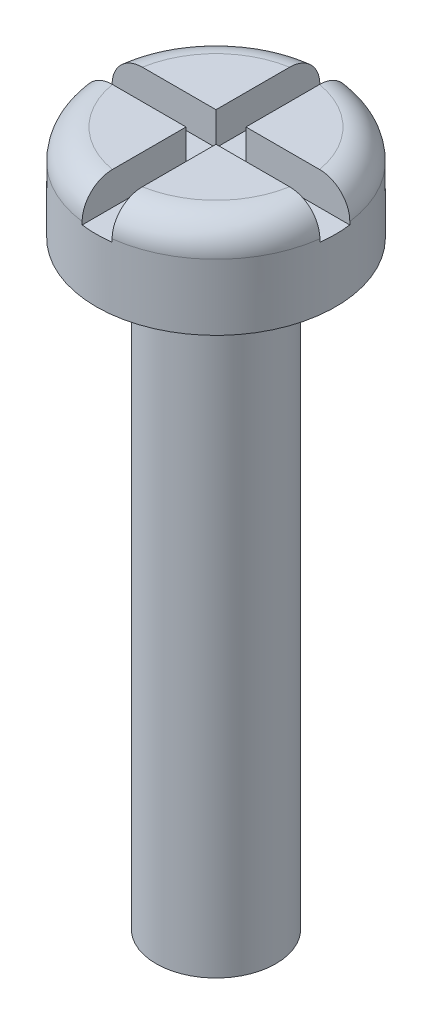
from build123d import *

# Parameters (mm, degrees)
SKETCH1_R           = 2
BOSS_EXTRUDE1_DEPTH = 1.6
SKETCH2_R           = 1
BOSS_EXTRUDE2_DEPTH = 10
FILLET1_R           = 0.5
CUT_EXTRUDE1_DEPTH  = 0.55


with BuildPart() as part:
    # Sketch1 → Boss-Extrude1 (new body)
    with BuildSketch(Plane(origin=(0, 0, 0), x_dir=(1, 0, 0), z_dir=(0, 1, 0))):
        with Locations(Location((0, 0, 0), (0, 0, 270))):
            Circle(SKETCH1_R)
    extrude(amount=BOSS_EXTRUDE1_DEPTH)

    # Sketch2 → Boss-Extrude2 (add)
    with BuildSketch(Plane.XZ):
        with Locations(Location((0, 0, 0), (0, 0, 90))):
            Circle(SKETCH2_R)
    extrude(amount=BOSS_EXTRUDE2_DEPTH)

    # Fillet1
    fillet1_edges = [part.edges().sort_by_distance(p)[0] for p in [
        (0, 1.6, -2),
    ]]
    fillet(fillet1_edges, radius=FILLET1_R)

    # Sketch3 → Cut-Extrude1 (cut)
    with BuildSketch(Plane(origin=(0, 1.6, 0), x_dir=(1, 0, 0), z_dir=(0, 1, 0))):
        Polygon((-2, -0.25), (-0.25, -0.25), (-0.25, -2), (0.25, -2), (0.25, -0.25), (2, -0.25), (2, 0.25), (0.25, 0.25), (0.25, 2), (-0.06766133, 2.298366751), (-0.25, 2), (-0.25, 0.25), (-2, 0.25), align=None)
    extrude(amount=-CUT_EXTRUDE1_DEPTH, mode=Mode.SUBTRACT)


solid = part.part
